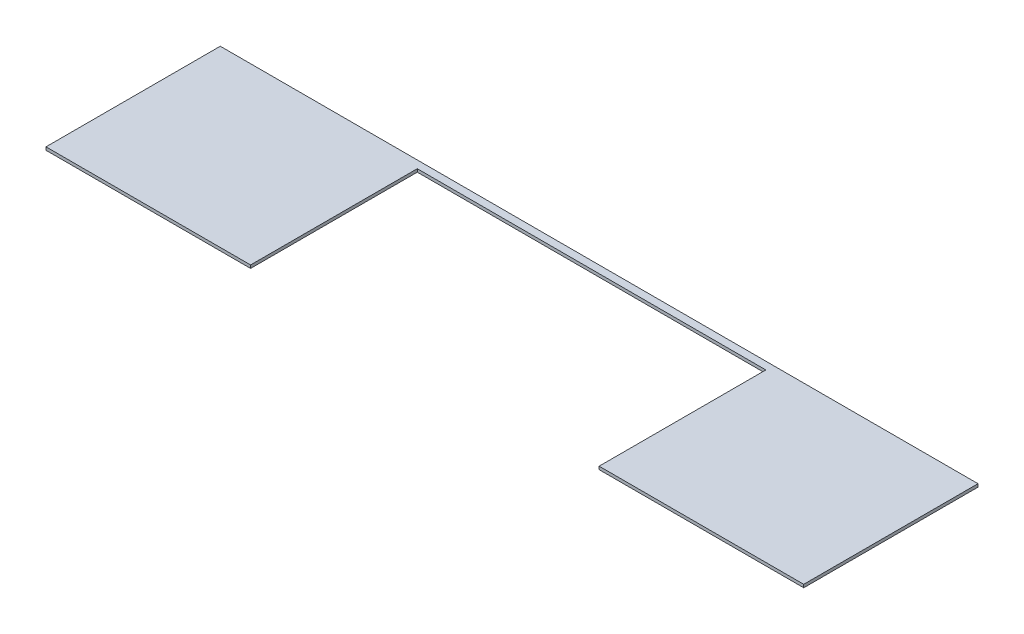
from build123d import *

# Parameters (mm, degrees)
SKETCH1_W           = 500
SKETCH1_H           = 115
BOSS_EXTRUDE1_DEPTH = 2
SKETCH2_W           = 230
SKETCH2_H           = 110
CUT_EXTRUDE1_DEPTH  = 10


with BuildPart() as part:
    # Sketch1 → Boss-Extrude1 (new body)
    with BuildSketch(Plane(origin=(0, 0, 0), x_dir=(1, 0, 0), z_dir=(0, 1, 0))):
        with Locations((73.487712665, 61.592627599)):
            Rectangle(SKETCH1_W, SKETCH1_H)
    extrude(amount=BOSS_EXTRUDE1_DEPTH)

    # Sketch2 → Cut-Extrude1 (cut)
    with BuildSketch(Plane(origin=(0, 2, 0), x_dir=(1, 0, 0), z_dir=(0, 1, 0))):
        with Locations((73.487712665, 59.092627599)):
            Rectangle(SKETCH2_W, SKETCH2_H)
    extrude(amount=-CUT_EXTRUDE1_DEPTH, mode=Mode.SUBTRACT)


solid = part.part
